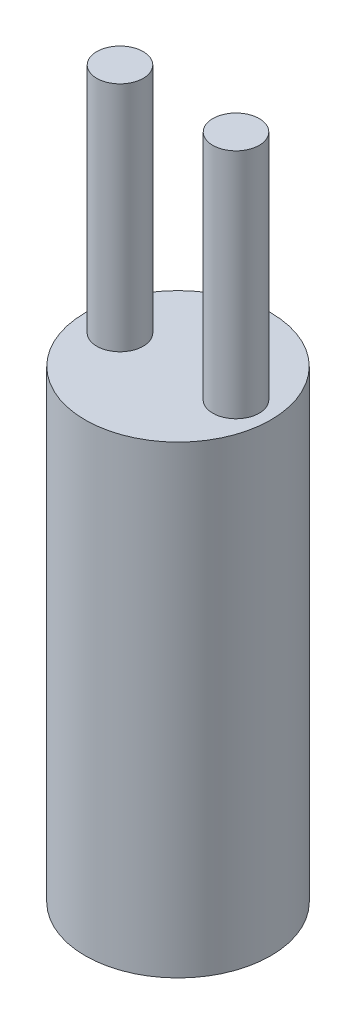
from build123d import *

# Parameters (mm, degrees)
SKETCH_1_R      = 4
EXTRUDE_1_DEPTH = 20
SKETCH_2_R      = 1
EXTRUDE_2_DEPTH = 10


with BuildPart() as part:
    # 草图1 → 凸台-拉伸1 (new body)
    with BuildSketch(Plane(origin=(0, 0, 0), x_dir=(1, 0, 0), z_dir=(0, 1, 0))):
        with Locations(Location((0, 0, 0), (0, 0, 270))):
            Circle(SKETCH_1_R)
    extrude(amount=EXTRUDE_1_DEPTH)

    # 草图2 → 凸台-拉伸2 (add)
    with BuildSketch(Plane(origin=(0, 20, 0), x_dir=(1, 0, 0), z_dir=(0, 1, 0))):
        with Locations(Location((-2.5, 0, 0), (0, 0, 270))):
            Circle(SKETCH_2_R)
    extrude_2 = extrude(amount=EXTRUDE_2_DEPTH)

    # 镜向1: 凸台-拉伸2 across plane
    add(extrude_2.mirror(Plane(origin=(0, 0, 0), x_dir=(0, 0, 1), z_dir=(1, 0, 0))))


solid = part.part
